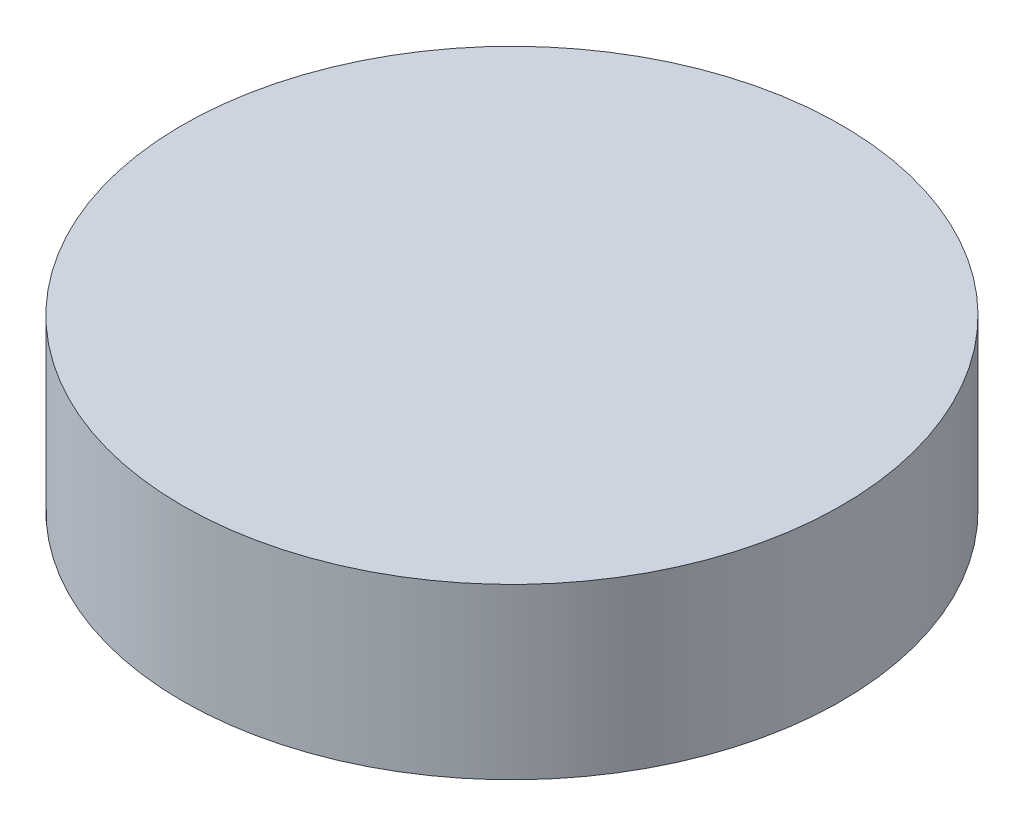
from build123d import *

# Parameters (mm, degrees)
SKETCH1_R           = 9.35
BOSS_EXTRUDE1_DEPTH = 4.8
CUT_EXTRUDE1_START  = -0.3
SKETCH2_R           = 8.1
CUT_EXTRUDE1_DEPTH  = 14.767160339


with BuildPart() as part:
    # Sketch1 → Boss-Extrude1 (new body)
    with BuildSketch(Plane(origin=(0, 0, 0), x_dir=(1, 0, 0), z_dir=(0, 1, 0))):
        with Locations(Location((0, 0, 0), (0, 0, 270))):
            Circle(SKETCH1_R)
    extrude(amount=BOSS_EXTRUDE1_DEPTH)

    # Sketch2 → Cut-Extrude1 (cut, through all)
    with BuildSketch(Plane(origin=(0, 4.8, 0), x_dir=(1, 0, 0), z_dir=(0, 1, 0)).offset(CUT_EXTRUDE1_START)):
        with Locations(Location((0, 0, 0), (0, 0, 270))):
            Circle(SKETCH2_R)
    extrude(amount=-CUT_EXTRUDE1_DEPTH, mode=Mode.SUBTRACT)


solid = part.part
